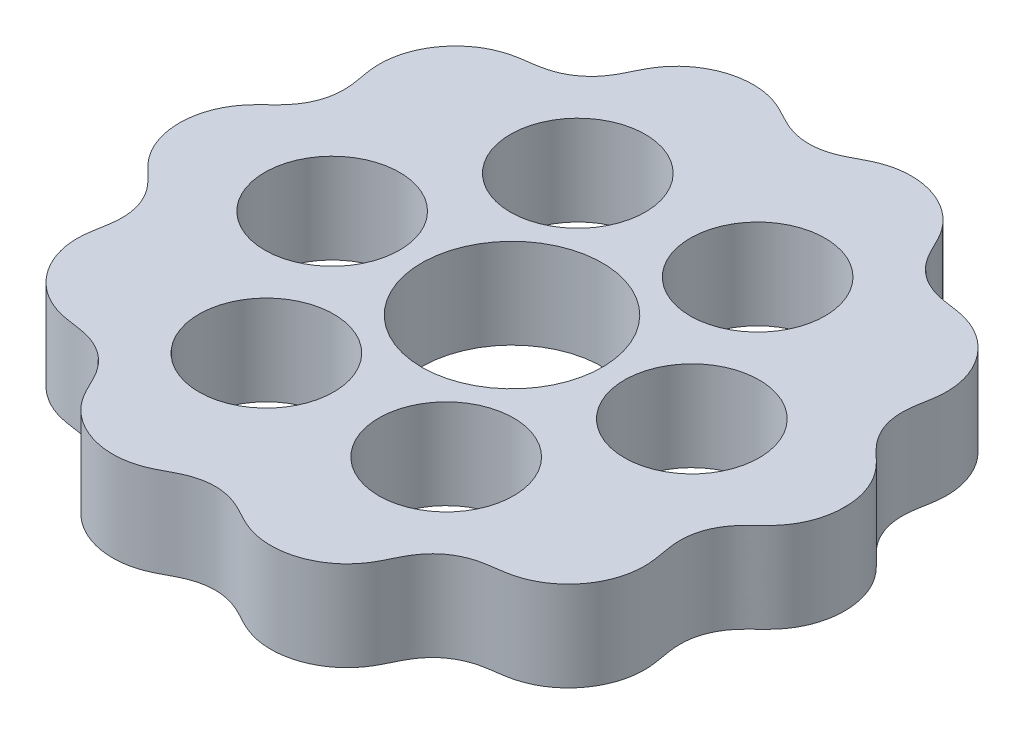
from build123d import *

# Parameters (mm, degrees)
SKETCH3_R           = 10.05
SKETCH3_R_2         = 7.5
BOSS_EXTRUDE1_DEPTH = 10


with BuildPart() as part:
    # Sketch3 → Boss-Extrude1 (new body)
    with BuildSketch(Plane(origin=(0, 0, 0), x_dir=(1, 0, 0), z_dir=(0, 1, 0))):
        with BuildLine():
            Line((36.999967263, 0.001559947), (37, 0))
            add(Edge.make_bspline(
                [(37, 0), (37, 0.0217622), (36.999810581, 0.05777333), (36.997963904, 0.18989323), (36.992016944, 0.403960917), (36.976829228, 0.659243716), (36.943217427, 1.007664679), (36.854306366, 1.654358156), (36.620760992, 2.642830635), (36.200428405, 3.657507693), (35.771635821, 4.422016136), (35.403883436, 4.969633273), (34.986623959, 5.496928195), (34.583756919, 5.936287622), (34.200755879, 6.318842885), (33.85775843, 6.649034231), (33.42193531, 7.068471831), (32.81467821, 7.689723222), (32.0280926, 8.687968085), (31.424168549, 9.984002109), (31.141678694, 11.051132882), (31.046081255, 12.001502975), (31.063134897, 12.993485902), (31.172367103, 13.787005523), (31.282189503, 14.41902224), (31.369603149, 14.903980083), (31.437150827, 15.316896413), (31.505128907, 15.814680839), (31.554271211, 16.389232099), (31.561080954, 17.054850546), (31.51557318, 17.710457613), (31.385230972, 18.577957635), (31.091976542, 19.642718026), (30.538686414, 20.861281567), (29.800018137, 21.983813276), (28.897553267, 22.97755722), (27.858050213, 23.813279746), (26.902711195, 24.358672766), (26.094536278, 24.699230762), (25.466711464, 24.906781834), (24.798876499, 25.072189504), (24.189910173, 25.179457117), (23.581064107, 25.265771591), (23.01819581, 25.34237938), (22.223805102, 25.471177029), (21.126171732, 25.742726764), (19.917620749, 26.32044569), (19.008906194, 26.962916842), (18.278081222, 27.693851509), (17.617330856, 28.564188304), (17.185441544, 29.340787641), (16.880917345, 29.954969212), (16.659111857, 30.415644864), (16.403199111, 30.929522354), (16.113348462, 31.457878799), (15.744338542, 32.030504604), (15.345588057, 32.55500045), (14.906989935, 33.045375853), (14.271422806, 33.650707272), (13.384739827, 34.313392322), (12.199147442, 34.937820224), (10.927179015, 35.372278567), (9.606352465, 35.604250223), (8.497035603, 35.62312144), (7.622236321, 35.533822842), (6.976636903, 35.415100016), (6.34096706, 35.24491032), (5.706773456, 35.020123971), (5.176228624, 34.786875158), (4.711444515, 34.555076675), (4.3023768, 34.340176211), (3.849344989, 34.096470508), (3.164964442, 33.744169052), (2.246776683, 33.344933204), (1.05180113, 33.056234967), (-0.040885301, 32.968529846), (-1.120800454, 33.070867286), (-2.291224117, 33.366591926), (-3.194145345, 33.765676409), (-3.847628783, 34.102794142), (-4.317472792, 34.35615524), (-4.710993428, 34.562921478), (-5.175206839, 34.793598762), (-5.709585291, 35.028020883), (-6.341548932, 35.251105371), (-6.976401683, 35.420223738), (-7.623715926, 35.538354062), (-8.498255345, 35.626575828), (-9.60740817, 35.606217243), (-10.928145398, 35.372726037), (-12.199819197, 34.936461346), (-13.383873468, 34.311139389), (-14.270591144, 33.64657042), (-14.904881708, 33.041013955), (-15.3420872, 32.550770347), (-15.741313224, 32.024423962), (-16.111230463, 31.448936584), (-16.396939877, 30.926598087), (-16.657895105, 30.401313825), (-16.849203555, 30.007527924), (-17.027700232, 29.643218628), (-17.286691122, 29.144862062), (-17.631771167, 28.530394268), (-18.319830082, 27.640477645), (-19.068778795, 26.911773748), (-19.983833197, 26.284364859), (-21.183563151, 25.728967652), (-22.254391315, 25.471942078), (-23.034781698, 25.346628141), (-23.593352778, 25.271148346), (-24.19587722, 25.185435477), (-24.805104227, 25.077666322), (-25.470568374, 24.911957335), (-26.098849801, 24.703432455), (-26.90596456, 24.362073541), (-27.861046389, 23.81526179), (-28.899452905, 22.978258044), (-29.800801772, 21.98328844), (-30.538017068, 20.859971311), (-31.089824101, 19.640662004), (-31.381646949, 18.575758155), (-31.51087447, 17.708279981), (-31.555607126, 17.051613809), (-31.547977618, 16.387693465), (-31.498036626, 15.810706324), (-31.429296195, 15.310714911), (-31.361998528, 14.900157463), (-31.272384419, 14.404726819), (-31.163227603, 13.768564429), (-31.053466494, 12.957622743), (-31.044827728, 11.940152308), (-31.152322092, 10.981006625), (-31.453440665, 9.906684894), (-32.065956454, 8.63913606), (-32.841924431, 7.668776233), (-33.440262657, 7.059699105), (-33.870382949, 6.646551437), (-34.210946272, 6.318505391), (-34.592948169, 5.93655447), (-34.992711705, 5.499571215), (-35.410849762, 4.970059205), (-35.776698243, 4.423533862), (-36.205061942, 3.658078596), (-36.624346523, 2.638936078), (-36.932202345, 1.338475893), (-37.03471307, -0.000813624), (-36.9289093, -1.339841636), (-36.617913899, -2.639205172), (-36.196068593, -3.657211168), (-35.765823011, -4.421489212), (-35.398489693, -4.967179283), (-34.978152063, -5.496915193), (-34.577050268, -5.933541616), (-34.189096978, -6.320507041), (-33.845835516, -6.650875869), (-33.403137225, -7.078016788), (-32.787015522, -7.710442586), (-31.987929298, -8.74368815), (-31.39775977, -10.057206367), (-31.131273346, -11.125749999), (-31.048513373, -12.057424488), (-31.066375418, -12.790375673), (-31.117383322, -13.327582058), (-31.20077751, -13.926630546), (-31.290154361, -14.417050955), (-31.377100251, -14.910070434), (-31.445434403, -15.326377855), (-31.512247781, -15.817334877), (-31.560542517, -16.390629262), (-31.566463432, -17.057680909), (-31.520195599, -17.713554218), (-31.38900375, -18.579075221), (-31.093909565, -19.645412853), (-30.539489486, -20.862251043), (-29.799176159, -21.98443206), (-28.895628723, -22.976816943), (-27.855256222, -23.811187911), (-26.898964149, -24.355443277), (-26.09097706, -24.694758269), (-25.461646811, -24.901879174), (-24.794568997, -25.06638405), (-24.181216235, -25.173760142), (-23.570900327, -25.260237479), (-22.998765275, -25.338417632), (-22.193505824, -25.470873109), (-21.072433348, -25.755332509), (-19.849112138, -26.359190919), (-18.950719873, -27.014970061), (-18.241046923, -27.742447387), (-17.596679989, -28.608187273), (-17.27084908, -29.199343824), (-17.022942161, -29.682346292), (-16.851125589, -30.03470424), (-16.661917065, -30.424719051), (-16.404289092, -30.942107202), (-16.118514297, -31.462159227), (-15.747970986, -32.035647309), (-15.347636636, -32.560716893), (-14.909202138, -33.049816045), (-14.273243711, -33.653879446), (-13.38471455, -34.31632442), (-12.198952194, -34.938809694), (-10.926212512, -35.371953737), (-9.605021639, -35.60216759), (-8.496049076, -35.619746721), (-7.621892529, -35.529321047), (-6.974876167, -35.40953601), (-6.340335788, -35.238782023), (-5.708233452, -35.01390519), (-5.172483087, -34.777516772), (-4.705344138, -34.544510219), (-4.306643006, -34.334628143), (-3.826901575, -34.076498661), (-3.151507778, -33.731069793), (-2.202123585, -33.32281591), (-0.978218557, -33.04228389), (0.118150839, -32.969870021), (1.191556639, -33.086712037), (2.332016756, -33.38799154), (3.214432647, -33.782461476), (3.85728476, -34.115744578), (4.323150876, -34.366951594), (4.713793902, -34.572155717), (5.17626869, -34.801472918), (5.710665159, -35.035182187), (6.341902245, -35.257187896), (6.977214635, -35.425544665), (7.624617781, -35.542843345), (8.499354635, -35.629966844), (9.608560026, -35.608234519), (10.929194322, -35.373035207), (12.199991156, -34.93542261), (13.383896337, -34.308179996), (14.268740565, -33.643380106), (14.902674915, -33.036519346), (15.340024272, -32.545024383), (15.737657397, -32.019254447), (16.10601502, -31.444689912), (16.396081447, -30.9135176), (16.654715823, -30.393028926), (16.880741749, -29.924082323), (17.196075273, -29.292715724), (17.654401635, -28.484565217), (18.360253376, -27.590639025), (19.129242445, -26.861314153), (20.052669341, -26.248422421), (21.234204061, -25.718693402), (22.283352654, -25.472660409), (23.053210946, -25.350850918), (23.603581477, -25.276667007), (24.204117418, -25.191190794), (24.809478089, -25.083432803), (25.475574251, -24.916842416), (26.10241296, -24.707870928), (26.909697726, -24.3652681), (27.863812025, -23.817348932), (28.90142067, -22.978883356), (29.801505578, -21.982843529), (30.537389427, -20.858545027), (31.087580798, -19.638777695), (31.378082336, -18.573529138), (31.506202264, -17.705740407), (31.550046463, -17.04998008), (31.54158507, -16.383678367), (31.491031472, -15.807763737), (31.421779532, -15.3070844), (31.353001743, -14.889437456), (31.264228615, -14.396706201), (31.152890075, -13.746867077), (31.044650945, -12.918630303), (31.043548039, -11.883417885), (31.166112991, -10.901803536), (31.481863229, -9.836413981), (32.105546859, -8.587224428), (32.868454689, -7.64974648), (33.457742536, -7.0515957), (33.883447806, -6.643638087), (34.221441655, -6.317968055), (34.600348803, -5.938541765), (35.00087339, -5.499933688), (35.416268557, -4.972383485), (35.782504252, -4.424039273), (36.20935618, -3.658415118), (36.627209776, -2.64244235), (36.858335361, -1.653259867), (36.945655929, -1.006264516), (36.978412687, -0.657762818), (36.992973475, -0.402519739), (36.998396323, -0.188249388), (36.999919882, -0.05609931), (37.000020569, -0.020172181), (36.999967263, 0.001559947)],
                knots=[0.0721028, 0.0721028, 0.0721028, 0.0721028, 0.072520669, 0.072938538, 0.073774275, 0.075445749, 0.077117223, 0.078788697, 0.085474594, 0.092160491, 0.09550344, 0.098846388, 0.102189337, 0.105532285, 0.107203759, 0.108875233, 0.110546708, 0.112218182, 0.113889656, 0.114725393, 0.11556113, 0.116396868, 0.117232605, 0.118904079, 0.120575553, 0.122247027, 0.123918502, 0.125589976, 0.128932924, 0.132275873, 0.135618821, 0.13896177, 0.145647667, 0.152333563, 0.15901946, 0.165705357, 0.172391254, 0.179077151, 0.1824201, 0.185763048, 0.189105996, 0.192448945, 0.194120419, 0.195791893, 0.197463368, 0.199134842, 0.199970579, 0.200806316, 0.201642053, 0.20247779, 0.204149265, 0.205820739, 0.207492213, 0.209163687, 0.212506636, 0.215849584, 0.219192533, 0.222535481, 0.225878429, 0.232564326, 0.239250223, 0.24593612, 0.252622017, 0.259307914, 0.262650862, 0.265993811, 0.269336759, 0.272679708, 0.276022656, 0.277694131, 0.279365605, 0.281037079, 0.282708553, 0.284380027, 0.285215765, 0.286051502, 0.286887239, 0.287722976, 0.28939445, 0.291065924, 0.292737399, 0.294408873, 0.296080347, 0.299423296, 0.302766244, 0.306109192, 0.309452141, 0.312795089, 0.319480986, 0.326166883, 0.33285278, 0.339538677, 0.346224574, 0.349567522, 0.352910471, 0.356253419, 0.359596368, 0.362939316, 0.36461079, 0.366282265, 0.367118002, 0.367953739, 0.369625213, 0.37046095, 0.371296687, 0.372132424, 0.372968162, 0.374639636, 0.37631111, 0.377982584, 0.379654058, 0.382997007, 0.386339955, 0.389682904, 0.393025852, 0.399711749, 0.406397646, 0.413083543, 0.41976944, 0.426455337, 0.433141234, 0.436484182, 0.439827131, 0.443170079, 0.446513028, 0.448184502, 0.449855976, 0.45152745, 0.453198925, 0.454870399, 0.455706136, 0.456541873, 0.45737761, 0.458213347, 0.459884821, 0.461556296, 0.46322777, 0.464899244, 0.466570718, 0.469913667, 0.473256615, 0.476599564, 0.479942512, 0.486628409, 0.493314306, 0.500000203, 0.5066861, 0.513371997, 0.520057894, 0.523400842, 0.526743791, 0.530086739, 0.533429687, 0.535101162, 0.536772636, 0.53844411, 0.540115584, 0.541787059, 0.542622796, 0.543458533, 0.54429427, 0.545130007, 0.545965744, 0.546801481, 0.548472956, 0.55014443, 0.551815904, 0.553487378, 0.556830327, 0.560173275, 0.563516224, 0.566859172, 0.573545069, 0.580230966, 0.586916863, 0.59360276, 0.600288657, 0.606974554, 0.610317502, 0.61366045, 0.617003399, 0.620346347, 0.622017822, 0.623689296, 0.62536077, 0.627032244, 0.627867981, 0.628703718, 0.629539456, 0.630375193, 0.632046667, 0.632882404, 0.633718141, 0.635389615, 0.63706109, 0.640404038, 0.643746987, 0.647089935, 0.650432883, 0.653775832, 0.660461729, 0.667147626, 0.673833523, 0.68051942, 0.687205316, 0.690548265, 0.693891213, 0.697234162, 0.70057711, 0.703920059, 0.705591533, 0.707263007, 0.708934481, 0.710605956, 0.71227743, 0.713113167, 0.713948904, 0.714784641, 0.715620378, 0.717291853, 0.718963327, 0.720634801, 0.722306275, 0.723977749, 0.727320698, 0.730663646, 0.734006595, 0.737349543, 0.740692492, 0.747378389, 0.754064286, 0.760750183, 0.767436079, 0.774121976, 0.777464925, 0.780807873, 0.784150822, 0.78749377, 0.790836719, 0.792508193, 0.794179667, 0.795851141, 0.797522616, 0.798358353, 0.79919409, 0.800029827, 0.800865564, 0.802537038, 0.804208512, 0.805879987, 0.807551461, 0.810894409, 0.814237358, 0.817580306, 0.820923255, 0.827609152, 0.834295049, 0.840980945, 0.847666842, 0.854352739, 0.861038636, 0.864381585, 0.867724533, 0.871067482, 0.87441043, 0.876081904, 0.877753378, 0.879424853, 0.881096327, 0.882767801, 0.883603538, 0.884439275, 0.885275013, 0.88611075, 0.887782224, 0.889453698, 0.891125172, 0.892796647, 0.894468121, 0.897811069, 0.901154018, 0.904496966, 0.907839915, 0.914525812, 0.921211708, 0.922883183, 0.924554657, 0.926226131, 0.927061868, 0.927479737, 0.927897605, 0.927897605, 0.927897605, 0.927897605], degree=3))
        make_face()
        with Locations(Location((0, 0, 0), (0, 0, 270))):
            Circle(SKETCH3_R, mode=Mode.SUBTRACT)
        with Locations(Location((19.999999956, 0.001325938, 0), (0, 0, 270))):
            Circle(SKETCH3_R_2, mode=Mode.SUBTRACT)
        with Locations(Location((10.001148274, -17.319845069, 0), (0, 0, 270))):
            Circle(SKETCH3_R_2, mode=Mode.SUBTRACT)
        with Locations(Location((-9.998851682, -17.321171006, 0), (0, 0, 270))):
            Circle(SKETCH3_R_2, mode=Mode.SUBTRACT)
        with Locations(Location((-19.999999956, -0.001325938, 0), (0, 0, 270))):
            Circle(SKETCH3_R_2, mode=Mode.SUBTRACT)
        with Locations(Location((-10.001148274, 17.319845069, 0), (0, 0, 270))):
            Circle(SKETCH3_R_2, mode=Mode.SUBTRACT)
        with Locations(Location((9.998851682, 17.321171006, 0), (0, 0, 270))):
            Circle(SKETCH3_R_2, mode=Mode.SUBTRACT)
    extrude(amount=BOSS_EXTRUDE1_DEPTH)


solid = part.part
